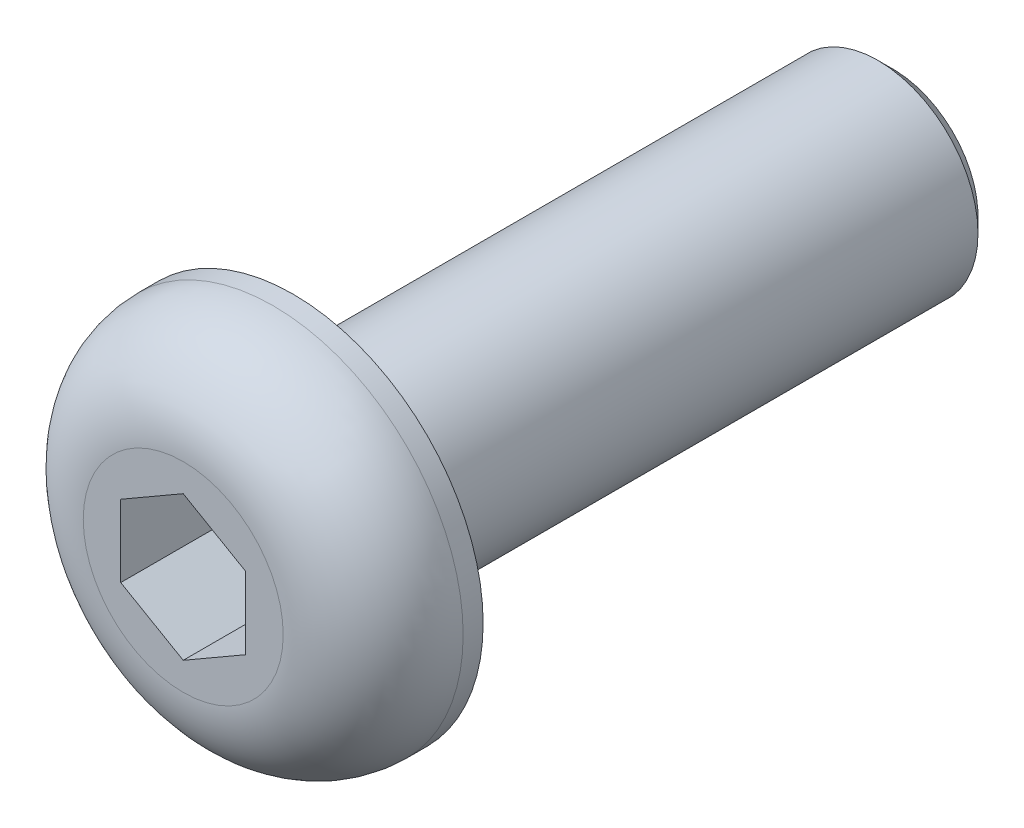
from build123d import *

# Parameters (mm, degrees)
SKETCH1_R           = 3.8
BOSS_EXTRUDE1_DEPTH = 2.2
SKETCH2_R           = 2
BOSS_EXTRUDE2_DEPTH = 12
CHAMFER1_SIZE       = 0.3
CUT_EXTRUDE1_DEPTH  = 2
FILLET1_R           = 1.8


with BuildPart() as part:
    # Sketch1 → Boss-Extrude1 (new body)
    with BuildSketch(Plane.XY):
        Circle(SKETCH1_R)
    extrude(amount=BOSS_EXTRUDE1_DEPTH)

    # Sketch2 → Boss-Extrude2 (add)
    with BuildSketch(Plane(origin=(0, 0, 0), x_dir=(-1, 0, 0), z_dir=(0, 0, -1))):
        with Locations(Location((0, 0, 0), (0, 0, 180))):
            Circle(SKETCH2_R)
    extrude(amount=BOSS_EXTRUDE2_DEPTH)

    # Chamfer1
    chamfer1_edges = [part.edges().sort_by_distance(p)[0] for p in [
        (-2, 0, -12),
    ]]
    chamfer(chamfer1_edges, length=CHAMFER1_SIZE)

    # Sketch3 → Cut-Extrude1 (cut)
    with BuildSketch(Plane.XY.offset(2.2)):
        Polygon((0, 1.443375673), (-1.25, 0.721687836), (-1.25, -0.721687836), (0, -1.443375673), (1.25, -0.721687836), (1.25, 0.721687836), align=None)
    extrude(amount=-CUT_EXTRUDE1_DEPTH, mode=Mode.SUBTRACT)

    # Fillet1
    fillet1_edges = [part.edges().sort_by_distance(p)[0] for p in [
        (-3.8, 0, 2.2),
    ]]
    fillet(fillet1_edges, radius=FILLET1_R)


solid = part.part
